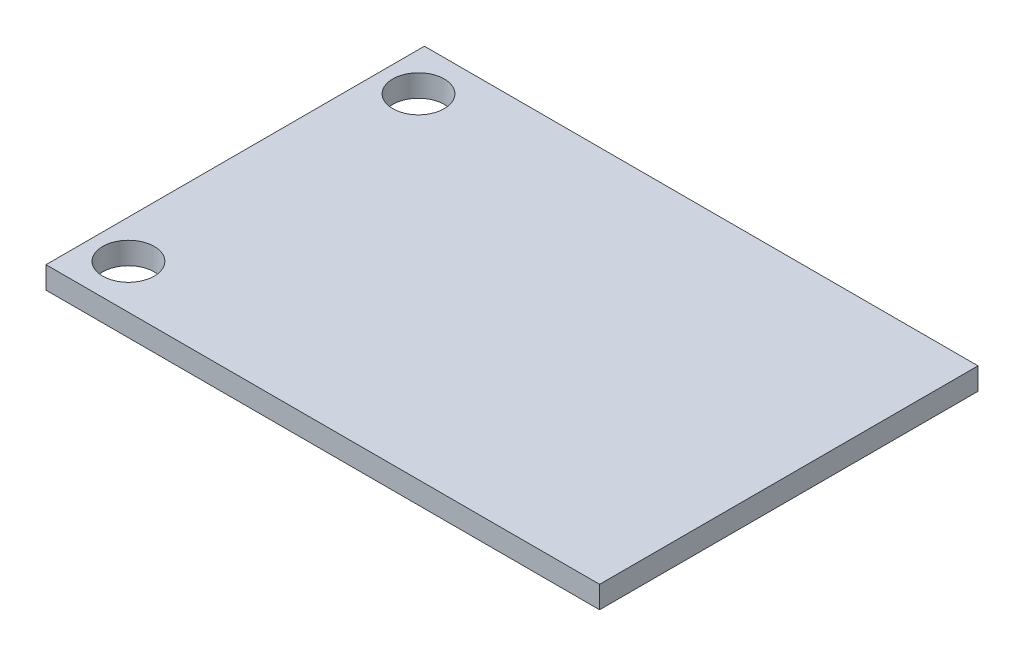
from build123d import *

# Parameters (mm, degrees)
SKETCH1_W           = 37.6
SKETCH1_H           = 25.7
BOSS_EXTRUDE1_DEPTH = 1.5
SKETCH2_R           = 1.75
CUT_EXTRUDE1_DEPTH  = 1.5


with BuildPart() as part:
    # Sketch1 → Boss-Extrude1 (new body)
    with BuildSketch(Plane(origin=(0, 0, 0), x_dir=(1, 0, 0), z_dir=(0, 1, 0))):
        with Locations((18.8, -12.85)):
            Rectangle(SKETCH1_W, SKETCH1_H)
    extrude(amount=BOSS_EXTRUDE1_DEPTH)

    # Sketch2 → Cut-Extrude1 (cut)
    with BuildSketch(Plane(origin=(0, 1.5, 0), x_dir=(1, 0, 0), z_dir=(0, 1, 0))):
        with Locations(Location((2.6, -3, 0), (0, 0, 270))):
            Circle(SKETCH2_R)
        with Locations(Location((2.6, -22.7, 0), (0, 0, 270))):
            Circle(SKETCH2_R)
    extrude(amount=-CUT_EXTRUDE1_DEPTH, mode=Mode.SUBTRACT)


solid = part.part
